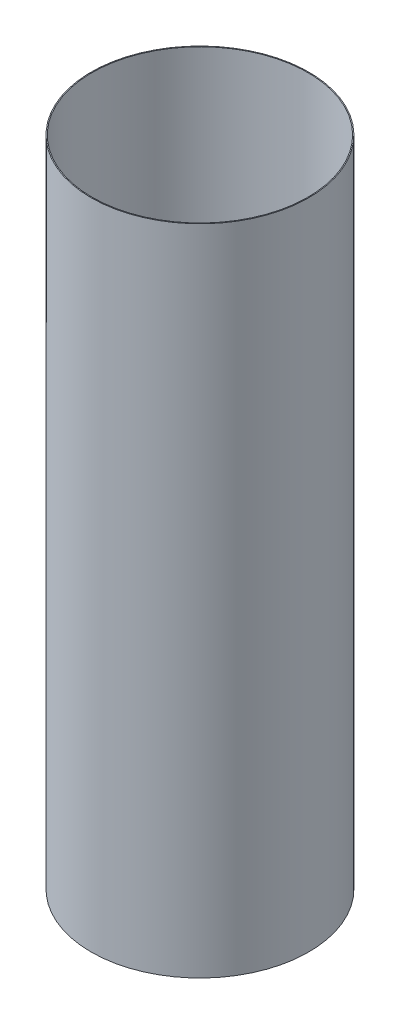
from build123d import *

# Parameters (mm, degrees)
SKETCH2_R           = 76.2
SKETCH2_R_2         = 75.565
BOSS_EXTRUDE1_DEPTH = 457.2


with BuildPart() as part:
    # Sketch2 → Boss-Extrude1 (new body)
    with BuildSketch(Plane(origin=(0, 0, 0), x_dir=(1, 0, 0), z_dir=(0, 1, 0))):
        with Locations(Location((0, 0, 0), (0, 0, 270))):
            Circle(SKETCH2_R)
        with Locations(Location((0, 0, 0), (0, 0, 270))):
            Circle(SKETCH2_R_2, mode=Mode.SUBTRACT)
    extrude(amount=BOSS_EXTRUDE1_DEPTH)


solid = part.part
